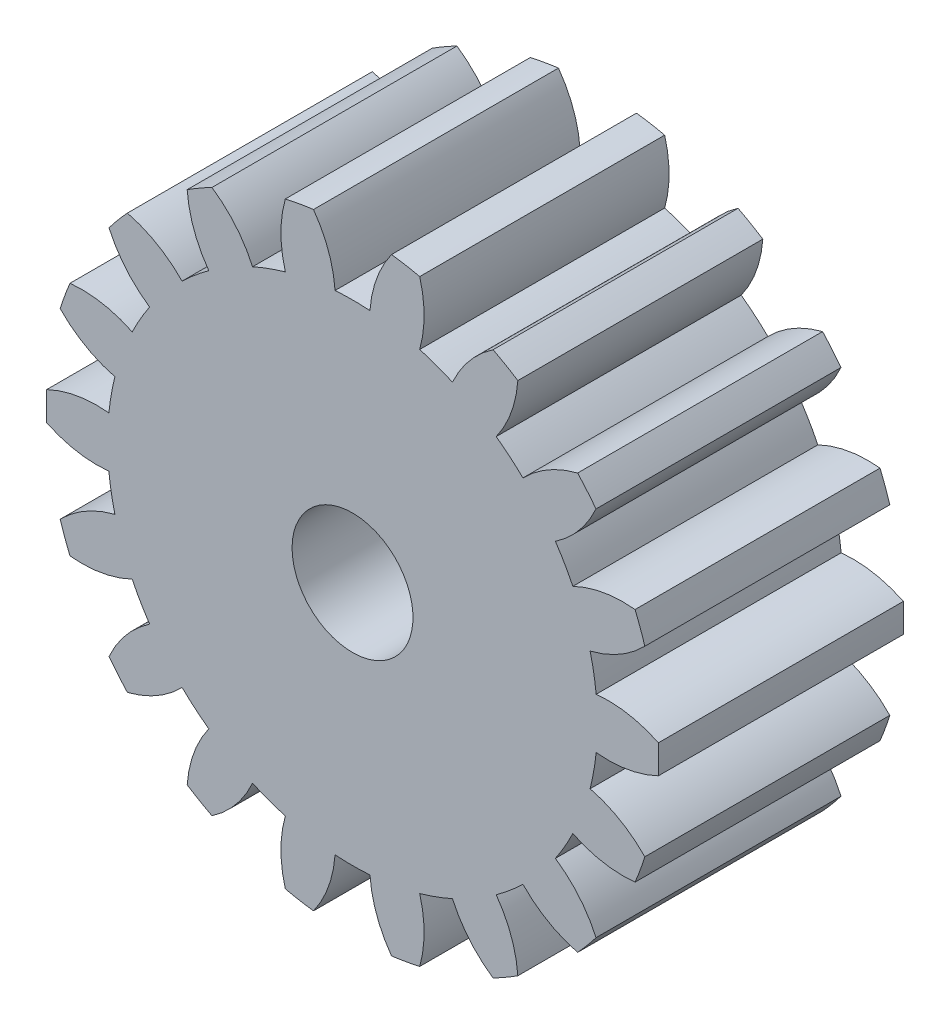
from build123d import *

# Parameters (mm, degrees)
SKETCH1_R           = 7.9375
OUTER_CIRCLE_DEPTH  = 6.35
TOOTH_CUT_DEPTH     = 13.896910967
TEETH_PATTERN_COUNT = 18
SKETCH3_R           = 1.56718
CUT_EXTRUDE1_DEPTH  = 13.857185215


with BuildPart() as part:
    # Sketch1 → Outer Circle (new body)
    with BuildSketch(Plane.XY):
        Circle(SKETCH1_R)
    extrude(amount=OUTER_CIRCLE_DEPTH)

    # Sketch2 → Tooth Cut (cut, through all)
    with BuildSketch(Plane.XY.offset(6.35)):
        with BuildLine():
            ThreePointArc((-0.452232993, 6.333876011), (0, 6.35), (0.452232993, 6.333876011))
            ThreePointArc((0.452232993, 6.333876011), (0.624488533, 7.142351531), (1.011484471, 7.872788922))
            ThreePointArc((1.011484471, 7.872788922), (0, 7.9375), (-1.011484471, 7.872788922))
            ThreePointArc((-1.011484471, 7.872788922), (-0.624488533, 7.142351531), (-0.452232993, 6.333876011))
        make_face()
    tooth_cut = extrude(amount=-TOOTH_CUT_DEPTH, mode=Mode.SUBTRACT)

    # Teeth Pattern: Tooth Cut ×18 about axis
    teeth_pattern_axis = Axis((0, 0, 0), (0, 0, 1))
    for i in range(1, TEETH_PATTERN_COUNT):
        add(tooth_cut.rotate(teeth_pattern_axis, i * 360 / TEETH_PATTERN_COUNT), mode=Mode.SUBTRACT)

    # Sketch3 → Cut-Extrude1 (cut, through all)
    with BuildSketch(Plane(origin=(0, 0, 0), x_dir=(-1, 0, 0), z_dir=(0, 0, -1))):
        Circle(SKETCH3_R)
    extrude(amount=-CUT_EXTRUDE1_DEPTH, mode=Mode.SUBTRACT)


solid = part.part
